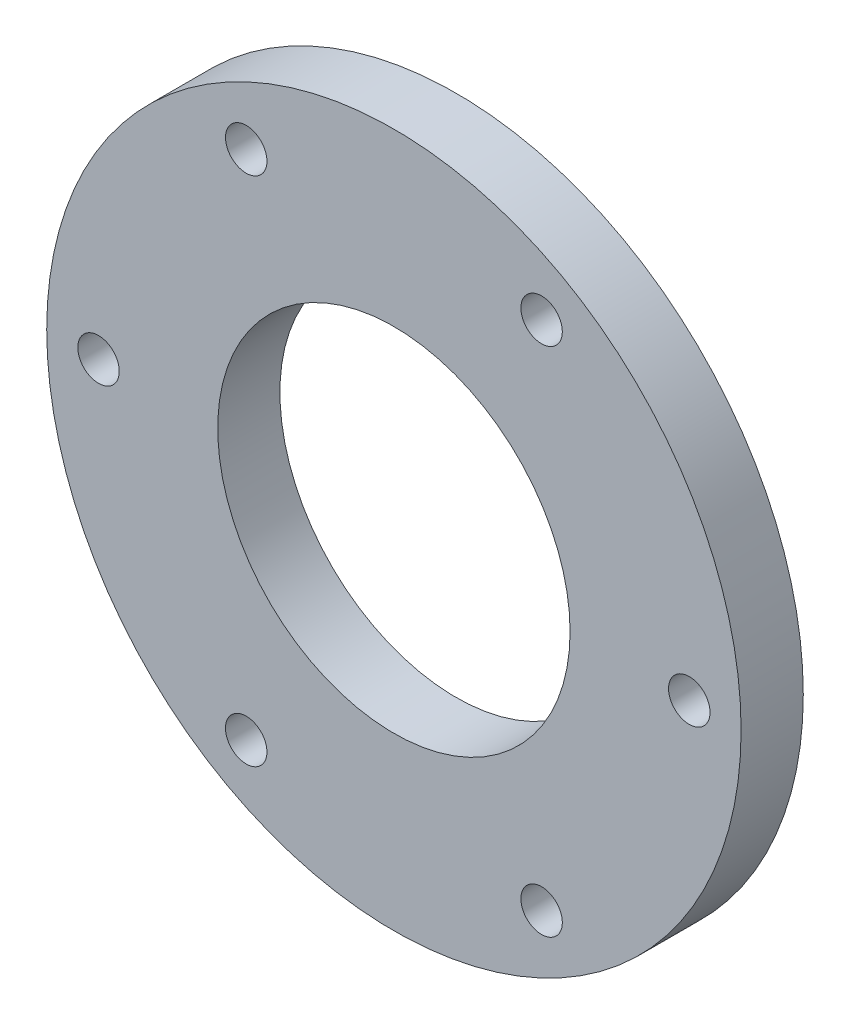
from build123d import *

# Parameters (mm, degrees)
SKETCH1_R                       = 33.5
SKETCH1_R_2                     = 17
BOSS_EXTRUDE1_DEPTH             = 6
F_4_0MM_DOWEL_HOLE1_D           = 4
F_4_0MM_DOWEL_HOLE1_DEPTH       = 24.5
F_4_0MM_DOWEL_HOLE1_CSINK_D     = 4.05
F_4_0MM_DOWEL_HOLE1_CSINK_ANGLE = 90
F_4_0MM_DOWEL_HOLE1_TIP         = 1.201721238


with BuildPart() as part:
    # Sketch1 → Boss-Extrude1 (new body)
    with BuildSketch(Plane.XY):
        Circle(SKETCH1_R)
        Circle(SKETCH1_R_2, mode=Mode.SUBTRACT)
    extrude(amount=BOSS_EXTRUDE1_DEPTH)

    # Ø4.0mm Dowel Hole1
    with Locations(Plane(origin=(28.5, 0, 0), x_dir=(-1, 0, 0), z_dir=(0, 0, -1))):
        with Locations((0, 0), (14.25, 24.681724008), (42.75, 24.681724008), (57, 0), (42.75, -24.681724008), (14.25, -24.681724008)):
            CounterSinkHole(F_4_0MM_DOWEL_HOLE1_D / 2, F_4_0MM_DOWEL_HOLE1_CSINK_D / 2, depth=F_4_0MM_DOWEL_HOLE1_DEPTH, counter_sink_angle=F_4_0MM_DOWEL_HOLE1_CSINK_ANGLE)
            with Locations((0, 0, -(F_4_0MM_DOWEL_HOLE1_DEPTH + F_4_0MM_DOWEL_HOLE1_TIP / 2))):  # 118° drill point
                Cone(0, F_4_0MM_DOWEL_HOLE1_D / 2, F_4_0MM_DOWEL_HOLE1_TIP, mode=Mode.SUBTRACT)


solid = part.part
